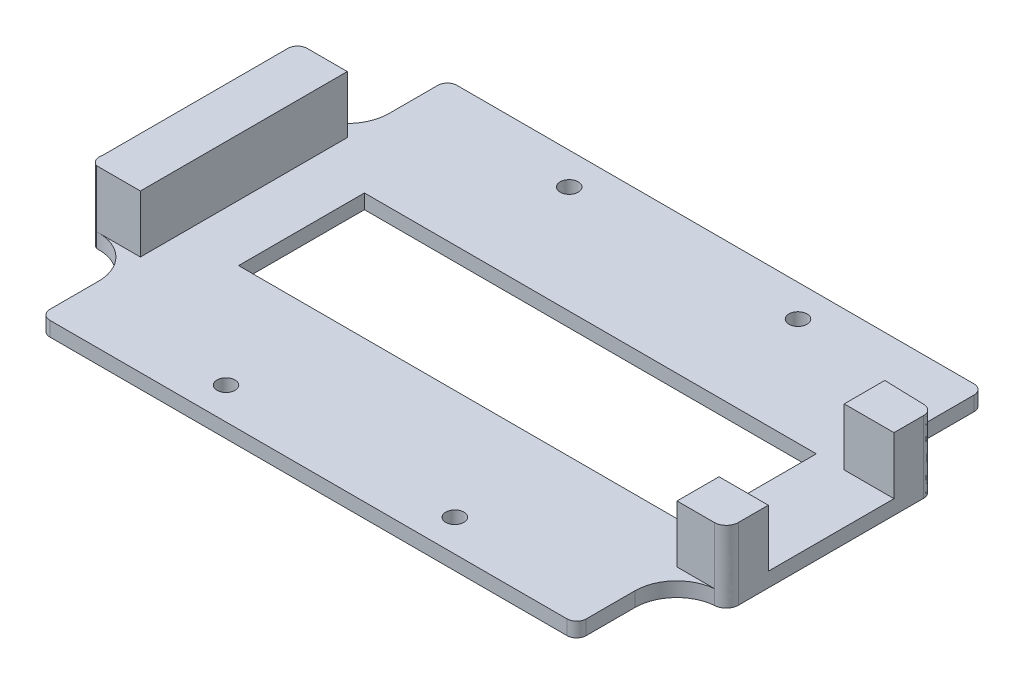
from build123d import *

# Parameters (mm, degrees)
SKETCH1_R           = 1.578396945
SKETCH1_W           = 79
SKETCH1_H           = 22
BOSS_EXTRUDE2_DEPTH = 2.54
BOSS_EXTRUDE3_DEPTH = 10


with BuildPart() as part:
    # Sketch1 → Boss-Extrude2 (new body)
    with BuildSketch(Plane(origin=(0, -197.546287398, 0), x_dir=(1, 0, 0), z_dir=(0, 1, 0))):
        with BuildLine():
            Line((-46.878416922, -25.602241557), (-46.878416922, -34.102241557))
            ThreePointArc((-46.878416922, -34.102241557), (-46.386819987, -35.289061544), (-45.2, -35.780658479))
            Line((-45.2, -35.780658479), (45.2, -35.780658479))
            ThreePointArc((45.2, -35.780658479), (46.386819987, -35.289061544), (46.878416922, -34.102241557))
            Line((46.878416922, -34.102241557), (46.878416922, -25.602241557))
            ThreePointArc((46.878416922, -25.602241557), (48.794516666, -20.66399163), (53.539905947, -18.310476992))
            add(Edge.make_bspline(
                [(53.539905947, -18.310476992), (53.808834541, -18.301511025), (54.349538715, -18.177417281), (55.023147103, -17.704797385), (55.473345475, -17.014152088), (55.578416916, -16.471377582), (55.578416922, -16.202870307)],
                knots=[0, 0, 0, 0, 0.001023741, 0.002047483, 0.003071224, 0.004094966, 0.004094966, 0.004094966, 0.004094966], degree=3))
            Line((55.578416922, -16.202870307), (55.578416922, 16.202870307))
            add(Edge.make_bspline(
                [(55.578416922, 16.202870307), (55.578416922, 16.417020125), (55.494048854, 16.850399632), (55.135979489, 17.398736831), (54.59856303, 17.775150348), (54.169613982, 17.873120493), (53.956037061, 17.880241063)],
                knots=[0, 0, 0, 0, 0.001023741, 0.002047483, 0.003071224, 0.004094966, 0.004094966, 0.004094966, 0.004094966], degree=3))
            ThreePointArc((53.956037061, 17.880241063), (48.93731184, 20.107602085), (46.878416939, 25.197758443))
            Line((46.878416939, 25.197758443), (46.878416939, 33.697758443))
            ThreePointArc((46.878416939, 33.697758443), (46.386819998, 34.884578436), (45.2, 35.376175365))
            Line((45.2, 35.376175365), (-45.2, 35.376175365))
            ThreePointArc((-45.2, 35.376175365), (-46.386819987, 34.88457843), (-46.878416922, 33.697758443))
            Line((-46.878416922, 33.697758443), (-46.878416922, 25.197758443))
            ThreePointArc((-46.878416922, 25.197758443), (-48.93731182, 20.107602071), (-53.956037052, 17.880241046))
            add(Edge.make_bspline(
                [(-53.956037052, 17.880241046), (-54.170067952, 17.873105344), (-54.600395569, 17.774343455), (-55.136497018, 17.398201742), (-55.494794219, 16.848541208), (-55.578416918, 16.416565886), (-55.578416922, 16.202870299)],
                knots=[0, 0, 0, 0, 0.001023741, 0.002047483, 0.003071224, 0.004094966, 0.004094966, 0.004094966, 0.004094966], degree=3))
            Line((-55.578416922, 16.202870299), (-55.578416922, -16.202870299))
            add(Edge.make_bspline(
                [(-55.578416922, -16.202870299), (-55.642358512, -16.407251091), (-55.69123907, -16.846051723), (-55.513228421, -17.476288615), (-55.112718518, -17.995994665), (-54.73258941, -18.21757272), (-54.530881465, -18.288139)],
                knots=[0, 0, 0, 0, 0.001023741, 0.002047483, 0.003071224, 0.004094966, 0.004094966, 0.004094966, 0.004094966], degree=3))
            ThreePointArc((-54.530881465, -18.288139), (-49.141195663, -20.309408908), (-46.878416922, -25.602241557))
        make_face()
        with Locations(Location((-20, 29.797758443, 0), (0, 0, 270))):
            Circle(SKETCH1_R, mode=Mode.SUBTRACT)
        with Locations(Location((-20, -30.202241557, 0), (0, 0, 270))):
            Circle(SKETCH1_R, mode=Mode.SUBTRACT)
        with Locations(Location((20, -30.202241557, 0), (0, 0, 270))):
            Circle(SKETCH1_R, mode=Mode.SUBTRACT)
        with Locations(Location((20.000000018, 29.79775846, 0), (0, 0, 270))):
            Circle(SKETCH1_R, mode=Mode.SUBTRACT)
        with Locations((2.5, 0)):
            Rectangle(SKETCH1_W, SKETCH1_H, mode=Mode.SUBTRACT)
    extrude(amount=BOSS_EXTRUDE2_DEPTH)

    # Sketch2 → Boss-Extrude3 (add)
    with BuildSketch(Plane(origin=(0, -195.006287398, 0), x_dir=(1, 0, 0), z_dir=(0, 1, 0))):
        with BuildLine():
            Line((-55.578416922, 16.202870299), (-55.578416922, -16.202870299))
            add(Edge.make_bspline(
                [(-55.578416922, -16.202870299), (-55.642358512, -16.407251091), (-55.69123907, -16.846051723), (-55.513228421, -17.476288615), (-55.112718518, -17.995994665), (-54.73258941, -18.21757272), (-54.530881465, -18.288139)],
                knots=[0, 0, 0, 0, 0.001023741, 0.002047483, 0.003071224, 0.004094966, 0.004094966, 0.004094966, 0.004094966], degree=3))
            Line((-54.530881465, -18.288139), (-46.878416922, -18.288139))
            Line((-46.878416922, -18.288139), (-46.878416922, 17.880241046))
            Line((-46.878416922, 17.880241046), (-53.956037052, 17.880241046))
            add(Edge.make_bspline(
                [(-53.956037052, 17.880241046), (-54.170067952, 17.873105344), (-54.600395569, 17.774343455), (-55.136497018, 17.398201742), (-55.494794219, 16.848541208), (-55.578416918, 16.416565886), (-55.578416922, 16.202870299)],
                knots=[0, 0, 0, 0, 0.001023741, 0.002047483, 0.003071224, 0.004094966, 0.004094966, 0.004094966, 0.004094966], degree=3))
        make_face()
        with BuildLine():
            Line((55.578416922, -10.974069665), (46.960695339, -10.974069665))
            Line((46.960695339, -10.974069665), (46.960695339, -18.310476992))
            Line((46.960695339, -18.310476992), (53.539905947, -18.310476992))
            add(Edge.make_bspline(
                [(53.539905947, -18.310476992), (53.808834541, -18.301511025), (54.349538715, -18.177417281), (55.023147103, -17.704797385), (55.473345475, -17.014152088), (55.578416916, -16.471377582), (55.578416922, -16.202870307)],
                knots=[0, 0, 0, 0, 0.001023741, 0.002047483, 0.003071224, 0.004094966, 0.004094966, 0.004094966, 0.004094966], degree=3))
            Line((55.578416922, -16.202870307), (55.578416922, -10.974069665))
        make_face()
        with BuildLine():
            Line((55.578416922, 10.999543279), (46.878416939, 10.999543279))
            Line((46.878416939, 10.999543279), (46.878416939, 18.098650861))
            Line((46.878416939, 18.098650861), (53.956037061, 17.880241063))
            add(Edge.make_bspline(
                [(55.578416922, 16.202870307), (55.578416922, 16.417020125), (55.494048854, 16.850399632), (55.135979489, 17.398736831), (54.59856303, 17.775150348), (54.169613982, 17.873120493), (53.956037061, 17.880241063)],
                knots=[0, 0, 0, 0, 0.001023741, 0.002047483, 0.003071224, 0.004094966, 0.004094966, 0.004094966, 0.004094966], degree=3))
            Line((55.578416922, 16.202870307), (55.578416922, 10.999543279))
        make_face()
    extrude(amount=BOSS_EXTRUDE3_DEPTH)


solid = part.part
